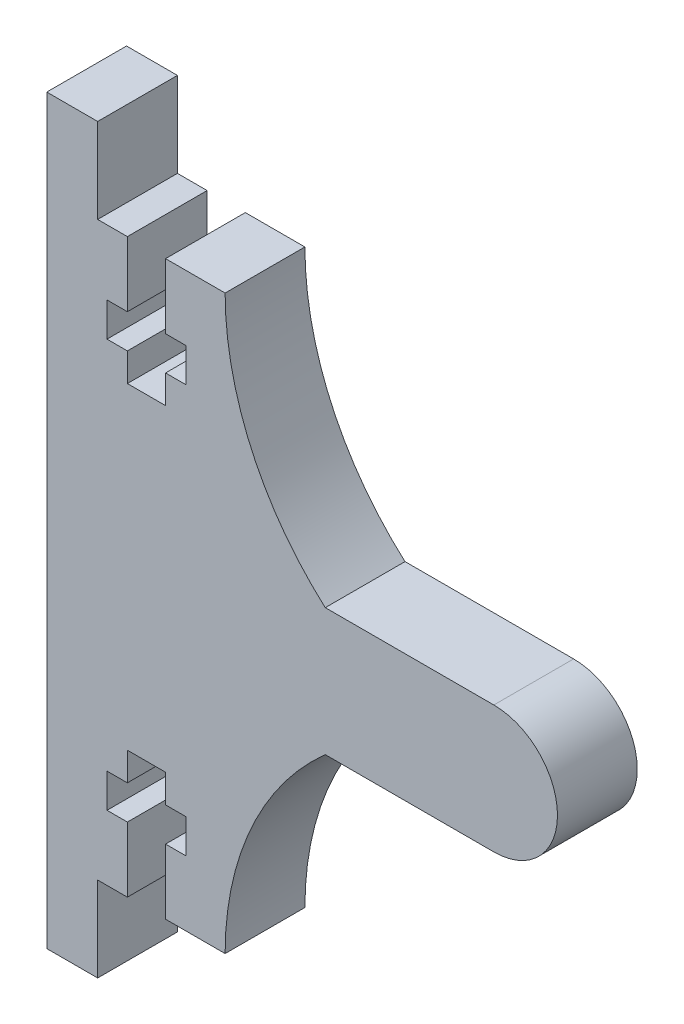
from build123d import *

# Parameters (mm, degrees)
BOSS_EXTRUDE1_DEPTH = 5.64


with BuildPart() as part:
    # Sketch1 → Boss-Extrude1 (new body)
    with BuildSketch(Plane.XY):
        with BuildLine():
            Line((652.899853243, 449.102981641), (640.981362844, 449.102981641))
            ThreePointArc((640.981362844, 449.102981641), (635.751899065, 456.204997772), (633.899853243, 464.827981641))
            Line((633.899853243, 464.827981641), (629.688308144, 464.827981641))
            Line((629.688308144, 464.827981641), (629.688308144, 460.227981641))
            Line((629.688308144, 460.227981641), (631.128193187, 460.227981641))
            Line((631.128193187, 460.227981641), (631.128193187, 457.827930641))
            Line((631.128193187, 457.827930641), (629.688308144, 457.827930641))
            Line((629.688308144, 457.827930641), (629.688308144, 455.827930641))
            Line((629.688308144, 455.827930641), (626.988308144, 455.827930641))
            Line((626.988308144, 455.827930641), (626.988308144, 457.827930641))
            Line((626.988308144, 457.827930641), (625.548423101, 457.827930641))
            Line((625.548423101, 457.827930641), (625.548423101, 460.227981641))
            Line((625.548423101, 460.227981641), (626.988308144, 460.227981641))
            Line((626.988308144, 460.227981641), (626.988308144, 464.827981641))
            Line((626.988308144, 464.827981641), (624.888308144, 464.827981641))
            Line((624.888308144, 464.827981641), (624.888308144, 470.827981641))
            Line((624.888308144, 470.827981641), (621.288308144, 470.827981641))
            Line((621.288308144, 470.827981641), (621.288308144, 464.827981641))
            Line((621.288308144, 464.827981641), (621.288308144, 424.377981641))
            Line((621.288308144, 424.377981641), (621.288308144, 418.377981641))
            Line((621.288308144, 418.377981641), (624.888308144, 418.377981641))
            Line((624.888308144, 418.377981641), (624.888308144, 424.377981641))
            Line((624.888308144, 424.377981641), (626.988308144, 424.377981641))
            Line((626.988308144, 424.377981641), (626.988308144, 428.977981641))
            Line((626.988308144, 428.977981641), (625.548423101, 428.977981641))
            Line((625.548423101, 428.977981641), (625.548423101, 431.378032641))
            Line((625.548423101, 431.378032641), (626.988308144, 431.378032641))
            Line((626.988308144, 431.378032641), (626.988308144, 433.378032641))
            Line((626.988308144, 433.378032641), (629.688308144, 433.378032641))
            Line((629.688308144, 433.378032641), (629.688308144, 431.378032641))
            Line((629.688308144, 431.378032641), (631.128193187, 431.378032641))
            Line((631.128193187, 431.378032641), (631.128193187, 428.977981641))
            Line((631.128193187, 428.977981641), (629.688308144, 428.977981641))
            Line((629.688308144, 428.977981641), (629.688308144, 424.377981641))
            Line((629.688308144, 424.377981641), (633.899853243, 424.377981641))
            ThreePointArc((633.899853243, 424.377981641), (635.751899065, 433.00096551), (640.981362844, 440.102981641))
            Line((640.981362844, 440.102981641), (652.899853243, 440.102981641))
            ThreePointArc((652.899853243, 440.102981641), (657.399853243, 444.602981641), (652.899853243, 449.102981641))
        make_face()
    extrude(amount=BOSS_EXTRUDE1_DEPTH)


solid = part.part
